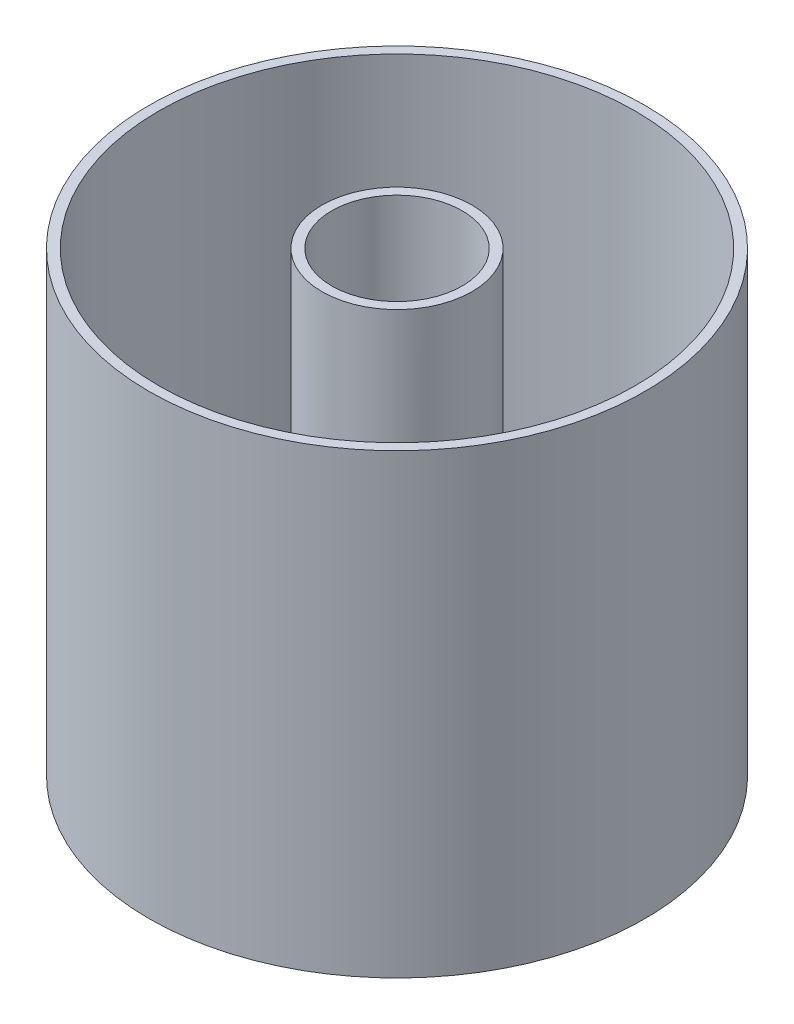
from build123d import *

# Parameters (mm, degrees)
SKETCH1_R             = 76
SKETCH1_R_2           = 73
BOSS_EXTRUDE3_DEPTH   = 135
SKETCH1_R_3           = 23
SKETCH1_R_4           = 20
BOSS_EXTRUDE3_2_DEPTH = 135
BOSS_EXTRUDE4_START   = 5
SKETCH2_R             = 76
BOSS_EXTRUDE4_DEPTH   = 5


with BuildPart() as part:
    # Sketch1 → Boss-Extrude3 (new body)
    with BuildSketch(Plane(origin=(0, 0, 0), x_dir=(1, 0, 0), z_dir=(0, 1, 0))):
        with Locations(Location((0, 0, 0), (0, 0, 270))):
            Circle(SKETCH1_R)
        with Locations(Location((0, 0, 0), (0, 0, 270))):
            Circle(SKETCH1_R_2, mode=Mode.SUBTRACT)
    extrude(amount=BOSS_EXTRUDE3_DEPTH)



with BuildPart() as body_2:
    # Sketch1 → Boss-Extrude3 2 (new body)
    with BuildSketch(Plane(origin=(0, 0, 0), x_dir=(1, 0, 0), z_dir=(0, 1, 0))):
        with Locations(Location((0, 0, 0), (0, 0, 270))):
            Circle(SKETCH1_R_3)
        with Locations(Location((0, 0, 0), (0, 0, 270))):
            Circle(SKETCH1_R_4, mode=Mode.SUBTRACT)
    extrude(amount=BOSS_EXTRUDE3_2_DEPTH)


with BuildPart() as part_1:
    add(part.part)

    add(body_2.part)  # Boss-Extrude4 merges body 2
    # Sketch2 → Boss-Extrude4 (add)
    with BuildSketch(Plane.XZ.offset(BOSS_EXTRUDE4_START)):
        with Locations(Location((0, 0, 0), (0, 0, 270))):
            Circle(SKETCH2_R)
    extrude(amount=-BOSS_EXTRUDE4_DEPTH)


solid = part_1.part
